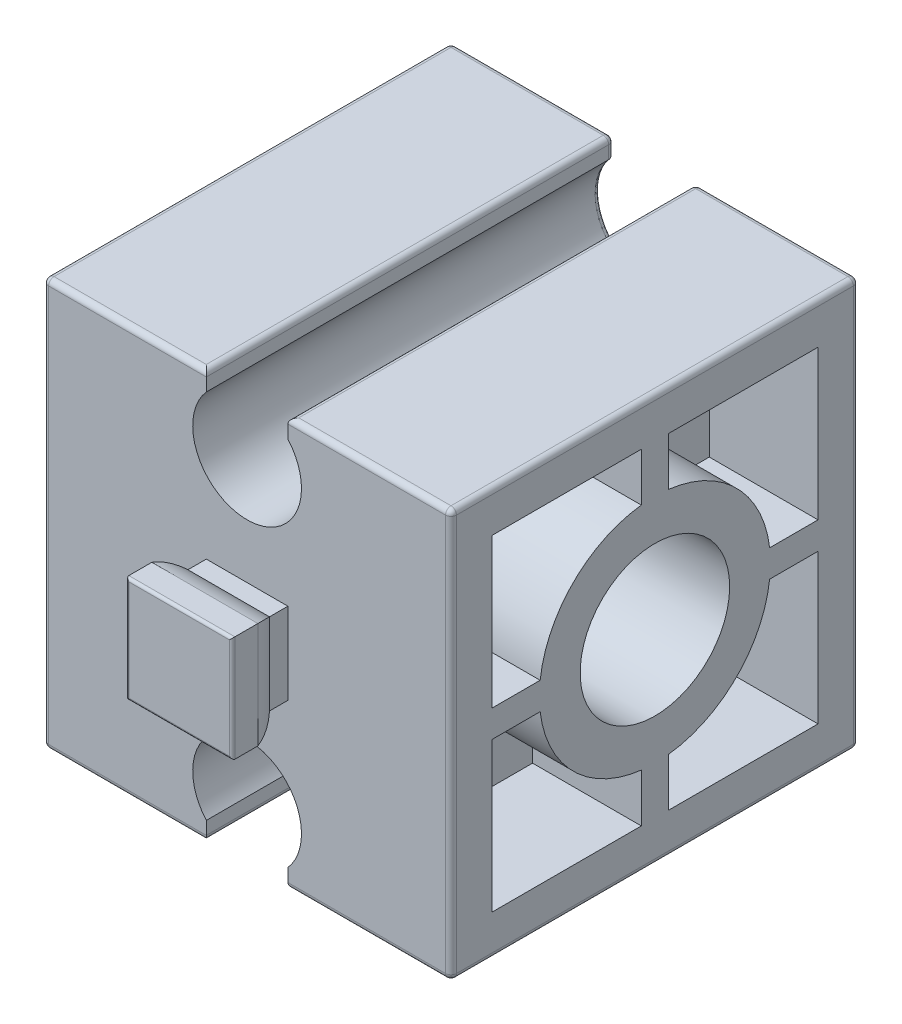
from build123d import *

# Parameters (mm, degrees)
SKETCH_1_W             = 15
SKETCH_1_H             = 15
EXTRUDE_1_DEPTH        = 15
SKETCH_2_W             = 3
SKETCH_2_H             = 3
EXTRUDE_2_DEPTH        = 1
EXTRUDE_3_DEPTH        = 4
CUT_EXTRUDE_1_DEPTH    = 1.95
SKETCH_5_R             = 2
CUT_EXTRUDE_2_DEPTH    = 9
CUT_EXTRUDE_3_DEPTH    = 4
CUT_EXTRUDE_5_DEPTH    = 19.371173071
FILLET_1_R             = 0.1
FILLET_2_R             = 0.2
FILLET_1_OF_MIRROR_2_R = 0.1
CUT_EXTRUDE_6_DEPTH    = 4
SKETCH_9_R             = 2.75
CUT_EXTRUDE_7_DEPTH    = 6


with BuildPart() as part:
    # 草图1 → 凸台-拉伸1 (new body)
    with BuildSketch(Plane.XY):
        Rectangle(SKETCH_1_W, SKETCH_1_H)
    extrude(amount=-EXTRUDE_1_DEPTH)

    # 草图2 → 凸台-拉伸2 (add)
    with BuildSketch(Plane.XY):
        Rectangle(SKETCH_2_W, SKETCH_2_H)
    extrude_2 = extrude(amount=EXTRUDE_2_DEPTH)

    # 草图5 → 切除-拉伸2 (cut)
    with BuildSketch(Plane.ZY.offset(7.5)):
        with Locations((-7.5, 0)):
            Circle(SKETCH_5_R)
    extrude(amount=-CUT_EXTRUDE_2_DEPTH, mode=Mode.SUBTRACT)

    # 草图6 → 切除-拉伸3 (cut)
    with BuildSketch(Plane.ZY.offset(7.5)):
        with BuildLine():
            Line((-8, 6.5), (-8, 2.958039892))
            ThreePointArc((-8, 2.958039892), (-9.621320344, 2.121320344), (-10.458039892, 0.5))
            Line((-10.458039892, 0.5), (-14, 0.5))
            Line((-14, 0.5), (-14, 6.5))
            Line((-14, 6.5), (-8, 6.5))
        make_face()
        with BuildLine():
            Line((-14, -6.5), (-8, -6.5))
            Line((-8, -6.5), (-8, -2.958039892))
            ThreePointArc((-8, -2.958039892), (-9.621320344, -2.121320344), (-10.458039892, -0.5))
            Line((-10.458039892, -0.5), (-14, -0.5))
            Line((-14, -0.5), (-14, -6.5))
        make_face()
        with BuildLine():
            Line((-1, -6.5), (-1, -0.5))
            Line((-1, -0.5), (-4.541960108, -0.5))
            ThreePointArc((-4.541960108, -0.5), (-5.378679656, -2.121320344), (-7, -2.958039892))
            Line((-7, -2.958039892), (-7, -6.5))
            Line((-7, -6.5), (-1, -6.5))
        make_face()
        with BuildLine():
            Line((-7, 6.5), (-7, 2.958039892))
            ThreePointArc((-7, 2.958039892), (-5.378679656, 2.121320344), (-4.541960108, 0.5))
            Line((-4.541960108, 0.5), (-1, 0.5))
            Line((-1, 0.5), (-1, 6.5))
            Line((-1, 6.5), (-7, 6.5))
        make_face()
    extrude(amount=-CUT_EXTRUDE_3_DEPTH, mode=Mode.SUBTRACT)

    # 草图7 → 切除-拉伸5 (cut, through all)
    with BuildSketch(Plane.XY):
        with BuildLine():
            Line((-1.5, -7.5), (-1.5, -6.822875656))
            ThreePointArc((-1.5, -6.822875656), (0, -3.5), (1.5, -6.822875656))
            Line((1.5, -6.822875656), (1.5, -7.5))
            Line((1.5, -7.5), (-1.5, -7.5))
        make_face()
        with BuildLine():
            Line((-1.5, 7.5), (1.5, 7.5))
            Line((1.5, 7.5), (1.5, 6.822875656))
            ThreePointArc((1.5, 6.822875656), (0, 3.5), (-1.5, 6.822875656))
            Line((-1.5, 6.822875656), (-1.5, 7.5))
        make_face()
    extrude(amount=-CUT_EXTRUDE_5_DEPTH, mode=Mode.SUBTRACT)

    # 圆角2
    fillet_2_edges = [part.edges().sort_by_distance(p)[0] for p in [
        (7.5, 0, -15),
        (-4.5, 7.5, -15),
        (-4.5, 7.5, 0),
        (0, 3.5, -15),
        (-1.5, 7.161437828, -15),
        (-1.5, 7.5, -7.5),
        (1.5, 7.161437828, -15),
        (1.5, 7.5, -7.5),
        (4.5, 7.5, -15),
        (4.5, -7.5, -15),
        (4.5, -7.5, 0),
        (1.5, -7.5, -7.5),
        (-1.5, -7.161437828, -15),
        (-1.5, -7.5, -7.5),
        (0, -3.5, -15),
        (1.5, -7.161437828, -15),
        (-7.5, 0, -15),
        (4.5, 7.5, 0),
        (7.5, 0, 0),
        (-4.5, -7.5, 0),
        (-7.5, 0, 0),
        (-4.5, -7.5, -15),
        (-7.5, 7.5, -7.5),
        (7.5, 7.5, -7.5),
        (7.5, -7.5, -7.5),
        (-7.5, -7.5, -7.5),
    ]]
    fillet(fillet_2_edges, radius=FILLET_2_R)


with BuildPart() as body_2:
    # 草图3 → 凸台-拉伸3 (new, symmetric)
    with BuildSketch(Plane(origin=(0, 0, 0), x_dir=(0, 0, -1), z_dir=(1, 0, 0))):
        with BuildLine():
            Line((-2.5, 1.95), (-2.5, -1.95))
            Line((-2.5, -1.95), (-1.555590279, -1.95))
            ThreePointArc((-1.555590279, -1.95), (-1.088161527, -1.780042303), (-0.677124344, -1.5))
            Line((-0.677124344, -1.5), (-0.677124344, 1.5))
            ThreePointArc((-0.677124344, 1.5), (-1.088161527, 1.780042303), (-1.555590279, 1.95))
            Line((-1.555590279, 1.95), (-2.5, 1.95))
        make_face()
    extrude_3 = extrude(amount=EXTRUDE_3_DEPTH, both=True)

    # 草图4 → 切除-拉伸1 (cut, symmetric)
    with BuildSketch(Plane(origin=(0, 0, 0), x_dir=(1, 0, 0), z_dir=(0, 1, 0))):
        with BuildLine():
            Line((-4, -2.5), (-1.95, -2.5))
            Line((-1.95, -2.5), (-1.95, -1.555590279))
            ThreePointArc((-1.95, -1.555590279), (-1.780042303, -1.088161527), (-1.5, -0.677124344))
            Line((-1.5, -0.677124344), (-4, -0.677124344))
            Line((-4, -0.677124344), (-4, -2.5))
        make_face()
        with BuildLine():
            Line((1.95, -2.5), (1.95, -1.555590279))
            ThreePointArc((1.95, -1.555590279), (1.780042303, -1.088161527), (1.5, -0.677124344))
            Line((1.5, -0.677124344), (4, -0.677124344))
            Line((4, -0.677124344), (4, -2.5))
            Line((4, -2.5), (1.95, -2.5))
        make_face()
    cut_extrude_1 = extrude(amount=CUT_EXTRUDE_1_DEPTH, both=True, mode=Mode.SUBTRACT)

    # 圆角1
    fillet_1_edges = [body_2.edges().sort_by_distance(p)[0] for p in [
        (0, 1.95, 2.5),
        (0, -1.95, 2.5),
        (-1.95, 0, 2.5),
        (1.95, 0, 2.5),
    ]]
    fillet(fillet_1_edges, radius=FILLET_1_R)


with BuildPart() as part_1:
    add(part.part)

    # 镜向2: 凸台-拉伸2, 凸台-拉伸3, 切除-拉伸1 across plane
    add(extrude_2.mirror(Plane.XY.offset(-7.5)))
    add(extrude_3.mirror(Plane.XY.offset(-7.5)))
    add(cut_extrude_1.mirror(Plane.XY.offset(-7.5)), mode=Mode.SUBTRACT)

    # 圆角1 of 镜向2
    fillet_1_of_mirror_2_edges = [part_1.edges().sort_by_distance(p)[0] for p in [
        (0, 1.95, -17.5),
        (0, -1.95, -17.5),
        (-1.95, 0, -17.5),
        (1.95, 0, -17.5),
    ]]
    fillet(fillet_1_of_mirror_2_edges, radius=FILLET_1_OF_MIRROR_2_R)

    # 草图8 → 切除-拉伸6 (cut)
    with BuildSketch(Plane(origin=(7.5, 0, 0), x_dir=(0, 0, -1), z_dir=(1, 0, 0))):
        with BuildLine():
            Line((13.5, 6), (13.5, 0.5))
            Line((13.5, 0.5), (11.720485754, 0.5))
            ThreePointArc((11.720485754, 0.5), (10.50520382, 3.00520382), (8, 4.220485754))
            Line((8, 4.220485754), (8, 6))
            Line((8, 6), (13.5, 6))
        make_face()
        with BuildLine():
            Line((13.5, -6), (8, -6))
            Line((8, -6), (8, -4.220485754))
            ThreePointArc((8, -4.220485754), (10.50520382, -3.00520382), (11.720485754, -0.5))
            Line((11.720485754, -0.5), (13.5, -0.5))
            Line((13.5, -0.5), (13.5, -6))
        make_face()
        with BuildLine():
            Line((1.5, 6), (1.5, 0.5))
            Line((1.5, 0.5), (3.279514246, 0.5))
            ThreePointArc((3.279514246, 0.5), (4.49479618, 3.00520382), (7, 4.220485754))
            Line((7, 4.220485754), (7, 6))
            Line((7, 6), (1.5, 6))
        make_face()
        with BuildLine():
            Line((7, -4.220485754), (7, -6))
            Line((7, -6), (1.5, -6))
            Line((1.5, -6), (1.5, -0.5))
            Line((1.5, -0.5), (3.279514246, -0.5))
            ThreePointArc((3.279514246, -0.5), (4.49479618, -3.00520382), (7, -4.220485754))
        make_face()
    extrude(amount=-CUT_EXTRUDE_6_DEPTH, mode=Mode.SUBTRACT)

    # 草图9 → 切除-拉伸7 (cut)
    with BuildSketch(Plane(origin=(7.5, 0, 0), x_dir=(0, 0, -1), z_dir=(1, 0, 0))):
        with Locations((7.5, 0)):
            Circle(SKETCH_9_R)
    extrude(amount=-CUT_EXTRUDE_7_DEPTH, mode=Mode.SUBTRACT)


solid = Compound([body_2.part, part_1.part])
